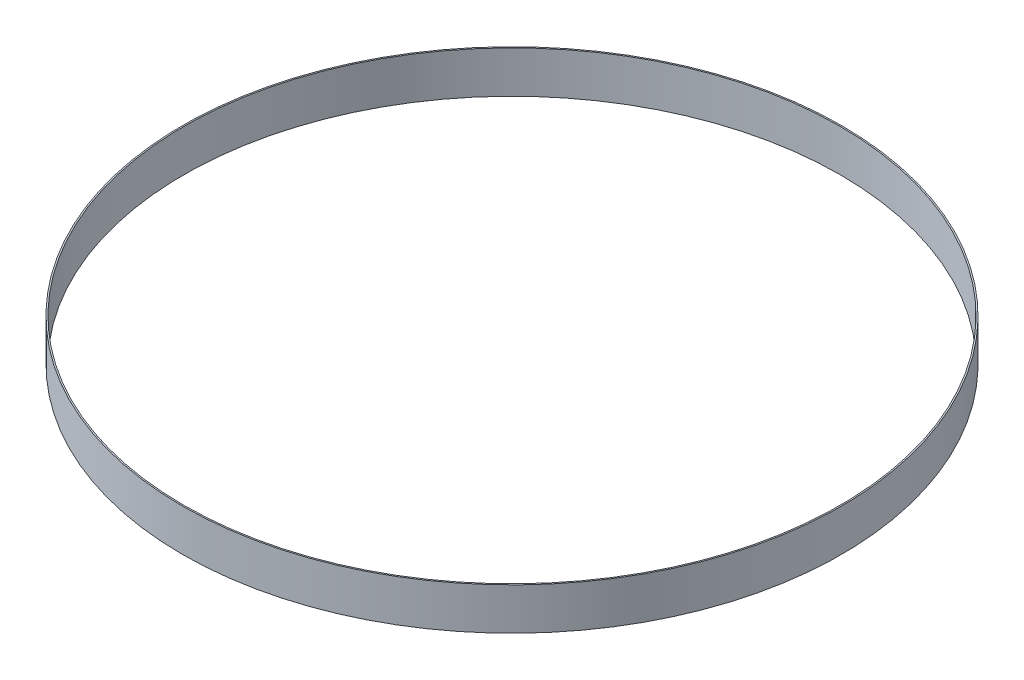
from build123d import *

# Parameters (mm, degrees)
SKETCH1_R           = 236
SKETCH1_R_2         = 235
BOSS_EXTRUDE1_DEPTH = 15


with BuildPart() as part:
    # Sketch1 → Boss-Extrude1 (new, symmetric)
    with BuildSketch(Plane(origin=(0, 0, 0), x_dir=(1, 0, 0), z_dir=(0, 1, 0))):
        with Locations(Location((0, 0, 0), (0, 0, 270))):
            Circle(SKETCH1_R)
        with Locations(Location((0, 0, 0), (0, 0, 270))):
            Circle(SKETCH1_R_2, mode=Mode.SUBTRACT)
    extrude(amount=BOSS_EXTRUDE1_DEPTH, both=True)


solid = part.part
